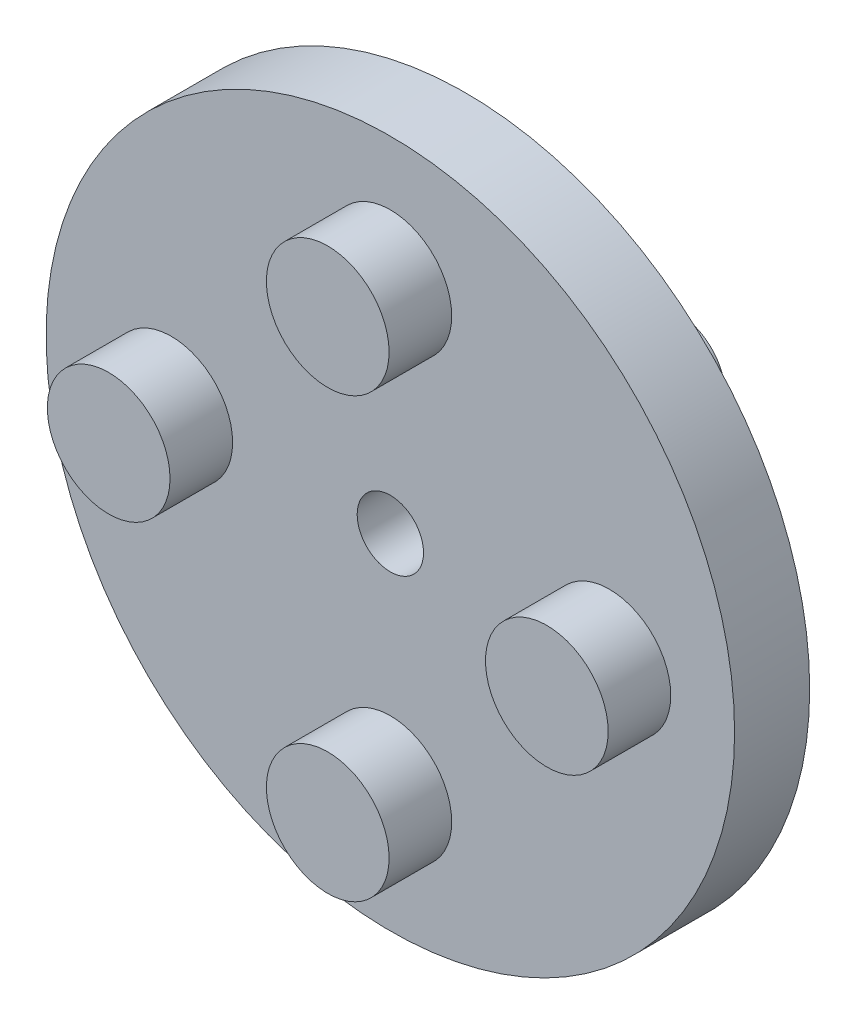
from build123d import *
from build123d.topology import SkipClean

# Parameters (mm, degrees)
SKETCH1_R           = 27.5
SKETCH1_R_2         = 2.65
BOSS_EXTRUDE1_DEPTH = 6
SKETCH2_R           = 4.9
BOSS_EXTRUDE2_DEPTH = 5
BOSS_EXTRUDE3_START = 17
SKETCH3_R           = 3.75
SKETCH3_R_2         = 2.65
BOSS_EXTRUDE3_DEPTH = 17


with BuildPart() as part:
    # Sketch1 → Boss-Extrude1 (new body)
    with BuildSketch(Plane.XY):
        Circle(SKETCH1_R)
        Circle(SKETCH1_R_2, mode=Mode.SUBTRACT)
    extrude(amount=BOSS_EXTRUDE1_DEPTH)

    # Sketch2 → Boss-Extrude2 (add)
    with BuildSketch(Plane.XY.offset(6)):
        with Locations((0, 17.5)):
            Circle(SKETCH2_R)
        with Locations((17.5, 0)):
            Circle(SKETCH2_R)
        with Locations((0, -17.5)):
            Circle(SKETCH2_R)
        with Locations((-17.5, 0)):
            Circle(SKETCH2_R)
    extrude(amount=BOSS_EXTRUDE2_DEPTH)

    # Sketch3 → Boss-Extrude3 (add)
    with SkipClean():  # the faces are left unmerged after this step: merging them gives an invalid solid
        with BuildSketch(Plane(origin=(0, 0, 0), x_dir=(-1, 0, 0), z_dir=(0, 0, -1)).offset(BOSS_EXTRUDE3_START)):
            with Locations(Location((0, 0, 0), (0, 0, 180))):
                Circle(SKETCH3_R)
            Circle(SKETCH3_R_2, mode=Mode.SUBTRACT)
        extrude(amount=-BOSS_EXTRUDE3_DEPTH)


solid = part.part
